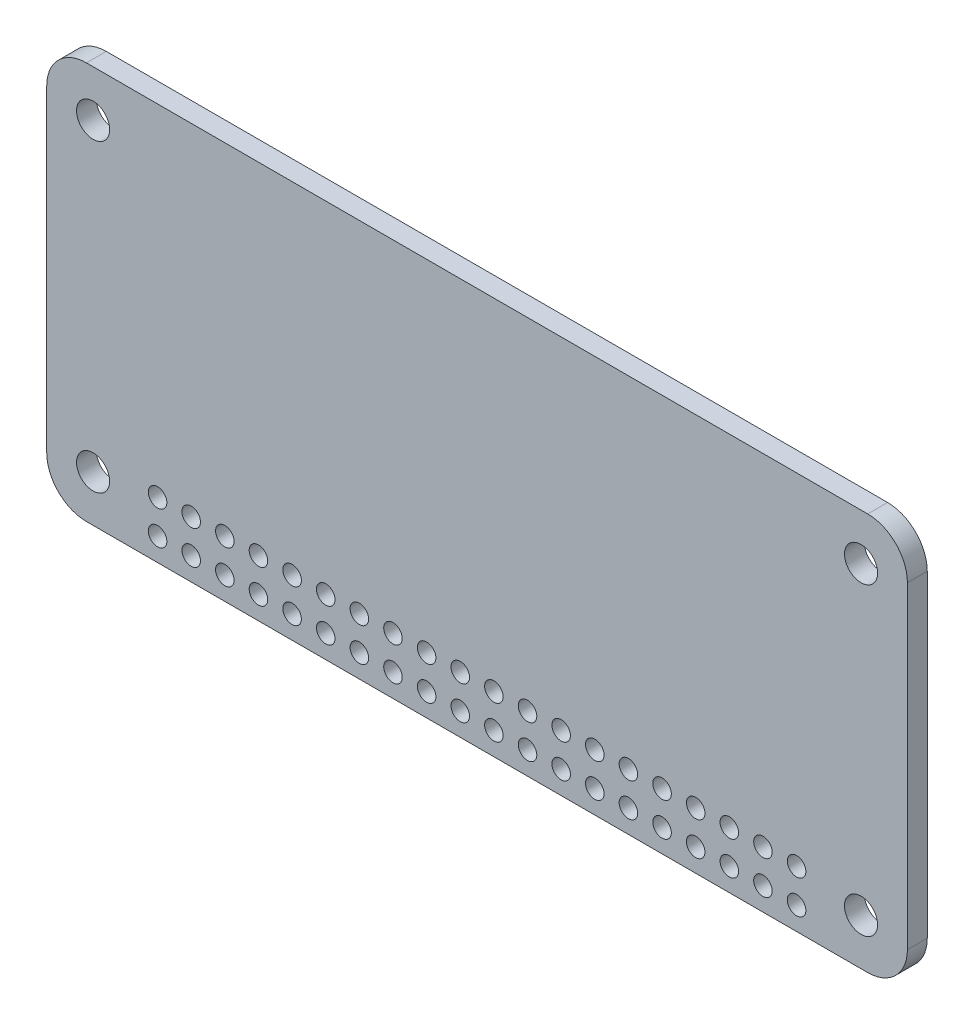
from build123d import *

# Parameters (mm, degrees)
CROQUIS1_R              = 0.7
CROQUIS1_R_2            = 1.25
SALIENTE_EXTRUIR1_DEPTH = 1.5


with BuildPart() as part:
    # Croquis1 → Saliente-Extruir1 (new body)
    with BuildSketch(Plane.XY):
        with BuildLine():
            Line((29.5, -15), (-29.5, -15))
            ThreePointArc((-29.5, -15), (-31.621320344, -14.121320344), (-32.5, -12))
            Line((-32.5, -12), (-32.5, 12))
            ThreePointArc((-32.5, 12), (-31.621320344, 14.121320344), (-29.5, 15))
            Line((-29.5, 15), (29.5, 15))
            ThreePointArc((29.5, 15), (31.621320344, 14.121320344), (32.5, 12))
            Line((32.5, 12), (32.5, -12))
            ThreePointArc((32.5, -12), (31.621320344, -14.121320344), (29.5, -15))
        make_face()
        with Locations((-24.13, -10.73)):
            Circle(CROQUIS1_R, mode=Mode.SUBTRACT)
        with Locations((-24.13, -13.27)):
            Circle(CROQUIS1_R, mode=Mode.SUBTRACT)
        with Locations((-21.59, -10.73)):
            Circle(CROQUIS1_R, mode=Mode.SUBTRACT)
        with Locations((-21.59, -13.27)):
            Circle(CROQUIS1_R, mode=Mode.SUBTRACT)
        with Locations((-19.05, -10.73)):
            Circle(CROQUIS1_R, mode=Mode.SUBTRACT)
        with Locations((-19.05, -13.27)):
            Circle(CROQUIS1_R, mode=Mode.SUBTRACT)
        with Locations((-16.51, -10.73)):
            Circle(CROQUIS1_R, mode=Mode.SUBTRACT)
        with Locations((-16.51, -13.27)):
            Circle(CROQUIS1_R, mode=Mode.SUBTRACT)
        with Locations((-13.97, -10.73)):
            Circle(CROQUIS1_R, mode=Mode.SUBTRACT)
        with Locations((-13.97, -13.27)):
            Circle(CROQUIS1_R, mode=Mode.SUBTRACT)
        with Locations((-11.43, -10.73)):
            Circle(CROQUIS1_R, mode=Mode.SUBTRACT)
        with Locations((-11.43, -13.27)):
            Circle(CROQUIS1_R, mode=Mode.SUBTRACT)
        with Locations((-8.89, -10.73)):
            Circle(CROQUIS1_R, mode=Mode.SUBTRACT)
        with Locations((-8.89, -13.27)):
            Circle(CROQUIS1_R, mode=Mode.SUBTRACT)
        with Locations((-6.35, -10.73)):
            Circle(CROQUIS1_R, mode=Mode.SUBTRACT)
        with Locations((-6.35, -13.27)):
            Circle(CROQUIS1_R, mode=Mode.SUBTRACT)
        with Locations((-3.81, -10.73)):
            Circle(CROQUIS1_R, mode=Mode.SUBTRACT)
        with Locations((-3.81, -13.27)):
            Circle(CROQUIS1_R, mode=Mode.SUBTRACT)
        with Locations((-1.27, -10.73)):
            Circle(CROQUIS1_R, mode=Mode.SUBTRACT)
        with Locations((-1.27, -13.27)):
            Circle(CROQUIS1_R, mode=Mode.SUBTRACT)
        with Locations((1.27, -10.73)):
            Circle(CROQUIS1_R, mode=Mode.SUBTRACT)
        with Locations((1.27, -13.27)):
            Circle(CROQUIS1_R, mode=Mode.SUBTRACT)
        with Locations((3.81, -10.73)):
            Circle(CROQUIS1_R, mode=Mode.SUBTRACT)
        with Locations((3.81, -13.27)):
            Circle(CROQUIS1_R, mode=Mode.SUBTRACT)
        with Locations((6.35, -10.73)):
            Circle(CROQUIS1_R, mode=Mode.SUBTRACT)
        with Locations((6.35, -13.27)):
            Circle(CROQUIS1_R, mode=Mode.SUBTRACT)
        with Locations((8.89, -10.73)):
            Circle(CROQUIS1_R, mode=Mode.SUBTRACT)
        with Locations((8.89, -13.27)):
            Circle(CROQUIS1_R, mode=Mode.SUBTRACT)
        with Locations((11.43, -10.73)):
            Circle(CROQUIS1_R, mode=Mode.SUBTRACT)
        with Locations((11.43, -13.27)):
            Circle(CROQUIS1_R, mode=Mode.SUBTRACT)
        with Locations((13.97, -10.73)):
            Circle(CROQUIS1_R, mode=Mode.SUBTRACT)
        with Locations((13.97, -13.27)):
            Circle(CROQUIS1_R, mode=Mode.SUBTRACT)
        with Locations((16.51, -10.73)):
            Circle(CROQUIS1_R, mode=Mode.SUBTRACT)
        with Locations((16.51, -13.27)):
            Circle(CROQUIS1_R, mode=Mode.SUBTRACT)
        with Locations((19.05, -10.73)):
            Circle(CROQUIS1_R, mode=Mode.SUBTRACT)
        with Locations((19.05, -13.27)):
            Circle(CROQUIS1_R, mode=Mode.SUBTRACT)
        with Locations((21.59, -10.73)):
            Circle(CROQUIS1_R, mode=Mode.SUBTRACT)
        with Locations((21.59, -13.27)):
            Circle(CROQUIS1_R, mode=Mode.SUBTRACT)
        with Locations((24.13, -10.73)):
            Circle(CROQUIS1_R, mode=Mode.SUBTRACT)
        with Locations((24.13, -13.27)):
            Circle(CROQUIS1_R, mode=Mode.SUBTRACT)
        with Locations((-29, 11.5)):
            Circle(CROQUIS1_R_2, mode=Mode.SUBTRACT)
        with Locations(Location((29, 11.5, 0), (0, 0, 180))):
            Circle(CROQUIS1_R_2, mode=Mode.SUBTRACT)
        with Locations((29, -11.5)):
            Circle(CROQUIS1_R_2, mode=Mode.SUBTRACT)
        with Locations(Location((-29, -11.5, 0), (0, 0, 180))):
            Circle(CROQUIS1_R_2, mode=Mode.SUBTRACT)
    extrude(amount=SALIENTE_EXTRUIR1_DEPTH)


solid = part.part
